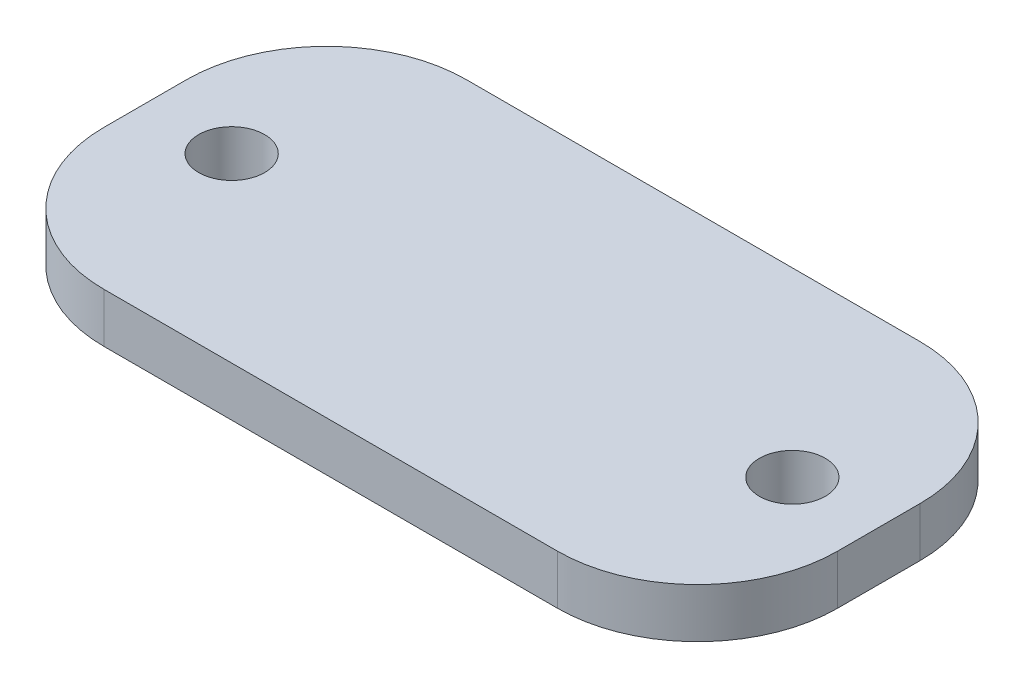
from build123d import *

# Parameters (mm, degrees)
ESBO_O1_W                = 44.5
ESBO_O1_H                = 22
RESSALTO_EXTRUS_O1_DEPTH = 3
FILETE1_R                = 8.5
ESBO_O2_R                = 2
CORTE_EXTRUS_O1_DEPTH    = 26.001249969


with BuildPart() as part:
    # Esboço1 → Ressalto-extrusão1 (new body)
    with BuildSketch(Plane(origin=(0, 0, 0), x_dir=(1, 0, 0), z_dir=(0, 1, 0))):
        Rectangle(ESBO_O1_W, ESBO_O1_H)
    extrude(amount=RESSALTO_EXTRUS_O1_DEPTH)

    # Filete1
    filete1_edges = [part.edges().sort_by_distance(p)[0] for p in [
        (22.25, 1.5, 11),
        (-22.25, 1.5, 11),
        (-22.25, 1.5, -11),
        (22.25, 1.5, -11),
    ]]
    fillet(filete1_edges, radius=FILETE1_R)

    # Esboço2 → Corte-extrusão1 (cut, through all)
    with BuildSketch(Plane(origin=(0, 3, 0), x_dir=(1, 0, 0), z_dir=(0, 1, 0))):
        with Locations(Location((-17, 0, 0), (0, 0, 270))):
            Circle(ESBO_O2_R)
        with Locations(Location((17, 0, 0), (0, 0, 270))):
            Circle(ESBO_O2_R)
    extrude(amount=-CORTE_EXTRUS_O1_DEPTH, mode=Mode.SUBTRACT)


solid = part.part
